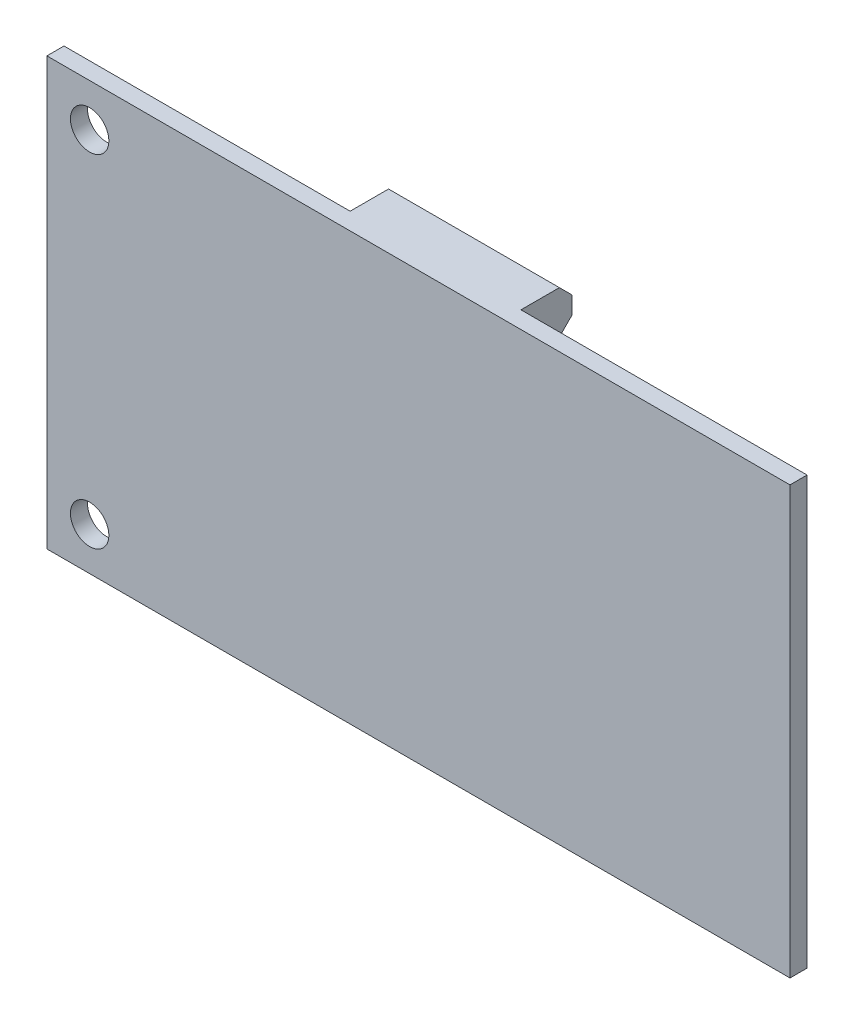
from build123d import *

# Parameters (mm, degrees)
SKETCH1_W            = 87
SKETCH1_H            = 50
BOSS_EXTRUDE1_DEPTH  = 2
SKETCH3_W            = 20
SKETCH3_H            = 6
BOSS_EXTRUDE2_DEPTH  = 5
CHAMFER1_SIZE        = 1.5
SKETCH4_W            = 10
SKETCH4_H            = 6
BOSS_EXTRUDE3_DEPTH  = 5
CHAMFER2_SIZE        = 1.5
SKETCH5_W            = 7
SKETCH5_H            = 2.5
BOSS_EXTRUDE4_DEPTH  = 6
M4_CLEARANCE_HOLE1_D = 4.5


with BuildPart() as part:
    # Sketch1 → Boss-Extrude1 (new body)
    with BuildSketch(Plane.XY):
        Rectangle(SKETCH1_W, SKETCH1_H)
    extrude(amount=BOSS_EXTRUDE1_DEPTH)

    # Sketch3 → Boss-Extrude2 (add)
    with BuildSketch(Plane(origin=(0, 25, 0), x_dir=(1, 0, 0), z_dir=(0, 1, 0))):
        with Locations((0, 3)):
            Rectangle(SKETCH3_W, SKETCH3_H)
    extrude(amount=-BOSS_EXTRUDE2_DEPTH)

    # Chamfer1
    chamfer1_edges = [part.edges().sort_by_distance(p)[0] for p in [
        (0, 20, -6),
        (0, 25, -6),
    ]]
    chamfer(chamfer1_edges, length=CHAMFER1_SIZE)

    # Sketch4 → Boss-Extrude3 (add)
    with BuildSketch(Plane.XZ.offset(25)):
        with Locations((-15, -3)):
            Rectangle(SKETCH4_W, SKETCH4_H)
    extrude(amount=-BOSS_EXTRUDE3_DEPTH)

    # Chamfer2
    chamfer2_edges = [part.edges().sort_by_distance(p)[0] for p in [
        (-15, -20, -6),
        (-15, -25, -6),
    ]]
    chamfer(chamfer2_edges, length=CHAMFER2_SIZE)

    # Sketch5 → Boss-Extrude4 (add)
    with BuildSketch(Plane(origin=(0, 0, 0), x_dir=(-1, 0, 0), z_dir=(0, 0, -1))):
        with Locations((-20, -23.75)):
            Rectangle(SKETCH5_W, SKETCH5_H)
    extrude(amount=BOSS_EXTRUDE4_DEPTH)

    # M4 Clearance Hole1 (through all)
    with Locations(Plane(origin=(0, 0, 0), x_dir=(-1, 0, 0), z_dir=(0, 0, -1))):
        with Locations((38.5, -20), (38.5, 20)):
            Hole(M4_CLEARANCE_HOLE1_D / 2)


solid = part.part
